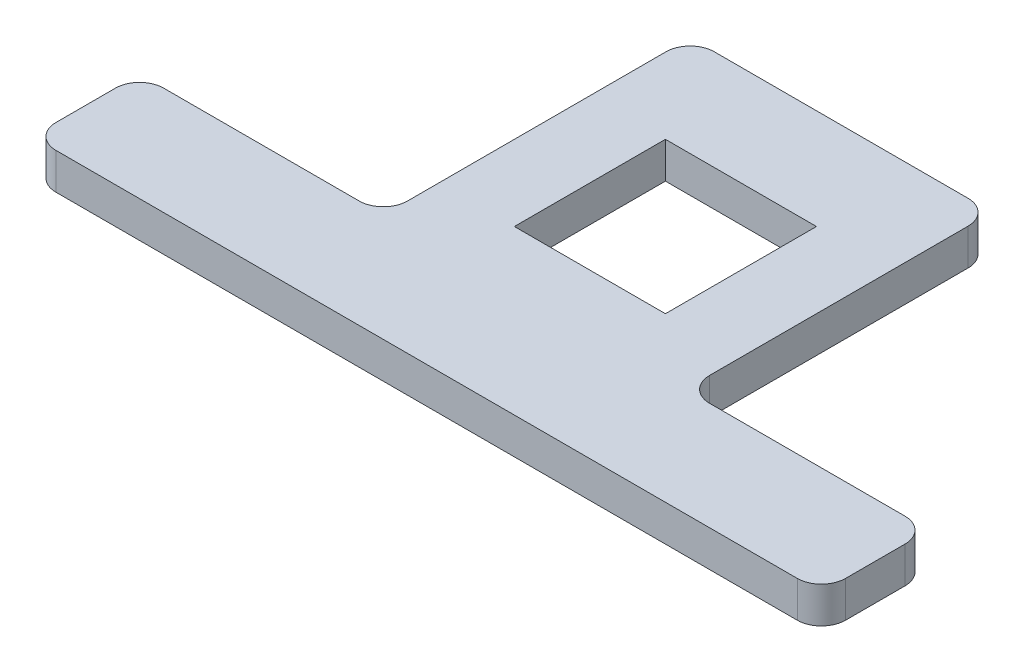
from build123d import *

# Parameters (mm, degrees)
BOSS_EXTRUDE1_DEPTH = 6
FILLET1_R           = 4
SKETCH2_W           = 25
SKETCH2_H           = 25
CUT_EXTRUDE1_DEPTH  = 6


with BuildPart() as part:
    # Sketch1 → Boss-Extrude1 (new body)
    with BuildSketch(Plane(origin=(0, 0, 0), x_dir=(1, 0, 0), z_dir=(0, 1, 0))):
        Polygon((-65.35, -34.31), (65.35, -34.31), (65.35, -16.47), (25, -16.47), (25, 34.31), (-25, 34.31), (-25, -16.47), (-65.35, -16.47), align=None)
    extrude(amount=BOSS_EXTRUDE1_DEPTH)

    # Fillet1
    fillet1_edges = [part.edges().sort_by_distance(p)[0] for p in [
        (25, 3, 16.47),
        (65.35, 3, 16.47),
        (65.35, 3, 34.31),
        (-65.35, 3, 34.31),
        (-65.35, 3, 16.47),
        (-25, 3, 16.47),
        (-25, 3, -34.31),
        (25, 3, -34.31),
    ]]
    fillet(fillet1_edges, radius=FILLET1_R)

    # Sketch2 → Cut-Extrude1 (cut)
    with BuildSketch(Plane(origin=(0, 6, 0), x_dir=(1, 0, 0), z_dir=(0, 1, 0))):
        with Locations((0, 5.216940009)):
            Rectangle(SKETCH2_W, SKETCH2_H)
    extrude(amount=-CUT_EXTRUDE1_DEPTH, mode=Mode.SUBTRACT)


solid = part.part
